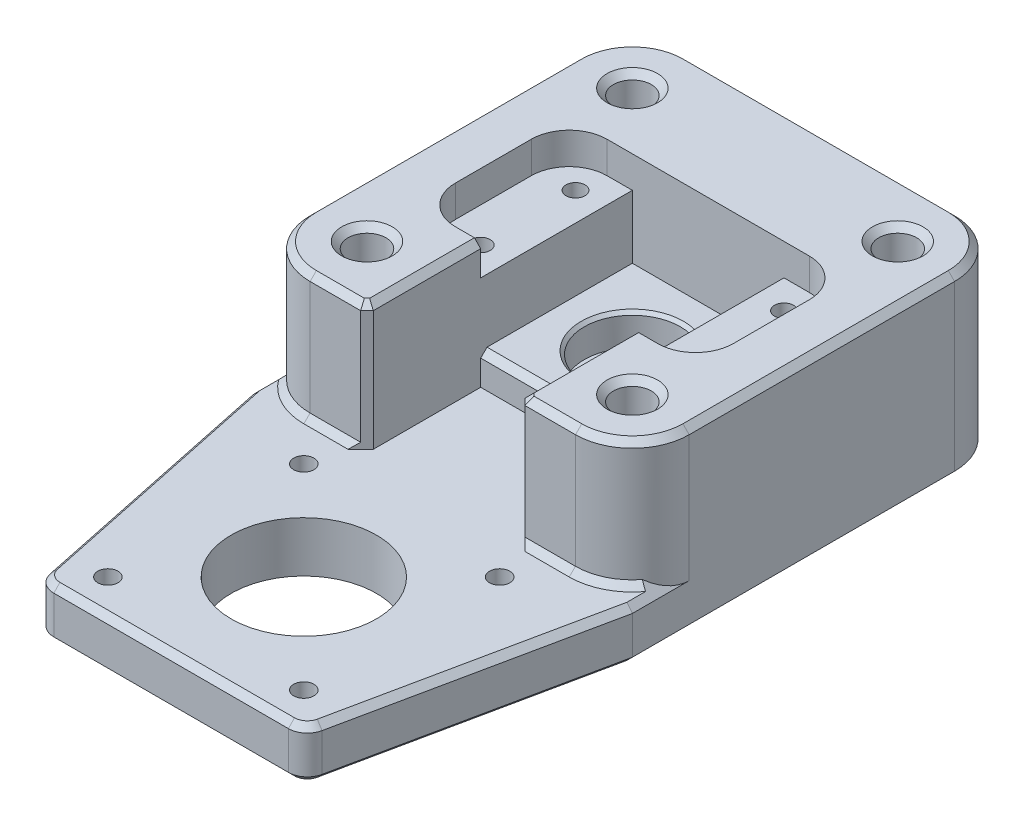
from build123d import *
from OCP.BRepFilletAPI import BRepFilletAPI_MakeChamfer

# Parameters (mm, degrees)
EXTRUDE_1_DEPTH      = 8
SKETCH_3_R           = 11.5
SKETCH_3_R_2         = 1.6
SKETCH_3_R_3         = 1.5999999999999992
SKETCH_3_R_4         = 1.6000000000000019
CUT_EXTRUDE_1_DEPTH  = 20
SKETCH_2_R           = 3.0000000000000018
SKETCH_2_R_2         = 3.0000000000000044
EXTRUDE_2_DEPTH      = 20
SKETCH_4_R           = 4.5
CUT_EXTRUDE_2_DEPTH  = 20
EXTRUDE_6_DEPTH      = 20
SKETCH_8_W           = 24.000000000000004
SKETCH_8_H           = 23.999999999999996
SKETCH_8_R           = 6.5
EXTRUDE_7_DEPTH      = 5
SKETCH_9_R           = 14.900000000000002
SKETCH_9_R_2         = 4.5
EXTRUDE_8_DEPTH      = 7
SKETCH_12_R          = 17.5
SKETCH_12_R_2        = 15
EXTRUDE_10_DEPTH     = 0.4
SKETCH_13_R          = 7.6000000000000005
CUT_EXTRUDE_4_DEPTH  = 5
FILLET_2_R           = 9
CUT_EXTRUDE_5_DEPTH  = 20
SKETCH_17_R          = 2.9999999999999996
SKETCH_17_R_2        = 2.999999999999998
SKETCH_17_R_3        = 3.0000000000000004
SKETCH_17_R_4        = 2.9999999999999987
CUT_EXTRUDE_8_DEPTH  = 3
FILLET_3_R           = 3
CHAMFER_3_SIZE       = 1
CHAMFER_4_SIZE       = 1
CHAMFER_8_SIZE       = 1
CHAMFER_11_SIZE      = 1
CHAMFER_11_SIZE2     = 0.9656887748070774
CHAMFER_12_SIZE      = 1
CHAMFER_12_SIZE2     = 0.9656887748070774
CUT_EXTRUDE_9_DEPTH  = 5
SKETCH_19_R          = 1.5000000000000009
CUT_EXTRUDE_10_DEPTH = 9.999999999999998
CHAMFER_14_SIZE      = 0.5
CHAMFER_15_SIZE      = 1
CHAMFER_16_SIZE      = 0.5
CUT_EXTRUDE_START    = -5
SKETCH_20_R          = 7.6000000000000005
CUT_EXTRUDE_11_DEPTH = 5
CHAMFER_17_SIZE      = 0.5


with BuildPart() as part:
    # 草图1 → 凸台-拉伸1 (new body)
    with BuildSketch(Plane(origin=(0, 0, 0), x_dir=(1, 0, 0), z_dir=(0, 1, 0))):
        Polygon((29.999999999999996, -7.000000000000006), (21.000000000000014, -50), (-20.999999999999986, -50), (-30.000000000000004, -7.000000000000006), (-30.000000000000004, 52.99999999999999), (29.999999999999996, 52.99999999999999), align=None)
    extrude(amount=EXTRUDE_1_DEPTH)

    # 草图3 → 切除-拉伸1 (cut)
    with BuildSketch(Plane(origin=(0, 8, 0), x_dir=(1, 0, 0), z_dir=(0, 1, 0))):
        with Locations(Location((1.33e-14, -29.000000000000007, 0), (0, 0, 270))):
            Circle(SKETCH_3_R)
        with Locations(Location((15.500000000000012, -13.500000000000009, 0), (0, 0, 270))):
            Circle(SKETCH_3_R_2)
        with Locations(Location((15.500000000000398, -44.500000000000064, 0), (0, 0, 270))):
            Circle(SKETCH_3_R_3)
        with Locations(Location((-15.499999999999662, -44.50000000000034, 0), (0, 0, 270))):
            Circle(SKETCH_3_R_3)
        with Locations(Location((-15.499999999999826, -13.500000000000288, 0), (0, 0, 270))):
            Circle(SKETCH_3_R_4)
    extrude(amount=-CUT_EXTRUDE_1_DEPTH, mode=Mode.SUBTRACT)

    # 草图2 → 凸台-拉伸2 (add)
    # profile 1 of 2: a face of its own
    with BuildSketch(Plane(origin=(0, 8, 0), x_dir=(1, 0, 0), z_dir=(0, 1, 0))):
        Polygon((-30.000000000000004, 52.99999999999999), (-12.000000000000005, 52.99999999999999), (-11.999999999999996, -7.000000000000006), (-29.999999999999996, -7.000000000000006), align=None)
        with Locations(Location((-21.000000000000004, 43.99999999999999, 0), (0, 0, 270))):
            Circle(SKETCH_2_R, mode=Mode.SUBTRACT)
        with Locations(Location((-20.999999999999993, 1.9999999999999931, 0), (0, 0, 270))):
            Circle(SKETCH_2_R_2, mode=Mode.SUBTRACT)
    # profile 2 of 2: a face of its own
    with BuildSketch(Plane(origin=(0, 8, 0), x_dir=(1, 0, 0), z_dir=(0, 1, 0))):
        Polygon((12.000000000000005, 52.99999999999999), (11.999999999999996, -7.000000000000006), (29.999999999999996, -7.000000000000006), (30.000000000000004, 52.99999999999999), align=None)
        with Locations(Location((20.999999999999993, 1.9999999999999931, 0), (0, 0, 90))):
            Circle(SKETCH_2_R_2, mode=Mode.SUBTRACT)
        with Locations(Location((21.000000000000004, 43.99999999999999, 0), (0, 0, 90))):
            Circle(SKETCH_2_R, mode=Mode.SUBTRACT)
    extrude(amount=EXTRUDE_2_DEPTH)

    # 草图4 → 切除-拉伸2 (cut)
    with BuildSketch(Plane(origin=(0, 8, 0), x_dir=(1, 0, 0), z_dir=(0, 1, 0))):
        with Locations(Location((0, 22.999999999999993, 0), (0, 0, 270))):
            Circle(SKETCH_4_R)
    extrude(amount=-CUT_EXTRUDE_2_DEPTH, mode=Mode.SUBTRACT)

    # 草图7 → 凸台-拉伸6 (add)
    with BuildSketch(Plane(origin=(0, 8, 0), x_dir=(1, 0, 0), z_dir=(0, 1, 0))):
        Polygon((12.000000000000304, 34.99999999999999), (-11.999999999999996, 34.99999999999999), (-11.999999999999996, 52.99999999999999), (12.000000000000313, 52.99999999999999), align=None)
    extrude(amount=EXTRUDE_6_DEPTH)

    # 草图8 → 凸台-拉伸7 (add)
    with BuildSketch(Plane(origin=(0, 8, 0), x_dir=(1, 0, 0), z_dir=(0, 1, 0))):
        with Locations((-1.78e-15, 22.999999999999993)):
            Rectangle(SKETCH_8_W, SKETCH_8_H)
        with Locations(Location((0, 22.999999999999993, 0), (0, 0, 270))):
            Circle(SKETCH_8_R, mode=Mode.SUBTRACT)
    extrude(amount=EXTRUDE_7_DEPTH)

    # 草图9 → 凸台-拉伸8 (add)
    with BuildSketch(Plane.XZ):
        with Locations(Location((0, -22.999999999999993, 0), (0, 0, 90))):
            Circle(SKETCH_9_R)
        with Locations(Location((0, -22.999999999999993, 0), (0, 0, 90))):
            Circle(SKETCH_9_R_2, mode=Mode.SUBTRACT)
    extrude(amount=EXTRUDE_8_DEPTH)

    # 草图12 → 凸台-拉伸10 (add)
    with BuildSketch(Plane.XZ):
        with Locations(Location((0, -22.999999999999993, 0), (0, 0, 90))):
            Circle(SKETCH_12_R)
        with Locations(Location((0, -22.999999999999993, 0), (0, 0, 270))):
            Circle(SKETCH_12_R_2, mode=Mode.SUBTRACT)
    extrude(amount=EXTRUDE_10_DEPTH)

    # 草图13 → 切除-拉伸4 (cut)
    with BuildSketch(Plane.XZ.offset(7)):
        with Locations(Location((0, -22.999999999999993, 0), (0, 0, 270))):
            Circle(SKETCH_13_R)
    extrude(amount=-CUT_EXTRUDE_4_DEPTH, mode=Mode.SUBTRACT)

    # 圆角2
    fillet_2_edges = [part.edges().sort_by_distance(p)[0] for p in [
        (-30.000000000000004, 14, -52.99999999999999),
        (30, 14, -52.99999999999999),
    ]]
    fillet(fillet_2_edges, radius=FILLET_2_R)

    # 草图14 → 切除-拉伸5 (cut)
    with BuildSketch(Plane(origin=(0, 28, 0), x_dir=(1, 0, 0), z_dir=(0, 1, 0))):
        with BuildLine():
            Line((-30.000000000000004, 1.9999999999999931), (-29.999999999999996, -7.000000000000006))
            Line((-29.999999999999996, -7.000000000000006), (-20.999999999999993, -7.000000000000015))
            ThreePointArc((-20.999999999999993, -7.000000000000015), (-27.36396103067893, -4.363961030678942), (-30.000000000000004, 1.9999999999999931))
        make_face()
        with BuildLine():
            Line((20.999999999999993, -7.000000000000006), (29.999999999999996, -7.000000000000006))
            Line((29.999999999999996, -7.000000000000006), (29.999999999999993, 1.9999999999999931))
            ThreePointArc((29.999999999999993, 1.9999999999999931), (27.363961030678922, -4.363961030678935), (20.999999999999993, -7.000000000000006))
        make_face()
    extrude(amount=-CUT_EXTRUDE_5_DEPTH, mode=Mode.SUBTRACT)

    # 草图17 → 切除-拉伸8 (cut)
    with BuildSketch(Plane.XZ):
        with Locations(Location((-15.499999999999826, 13.500000000000288, 0), (0, 0, 270))):
            Circle(SKETCH_17_R)
        with Locations(Location((-15.499999999999657, 44.4999999999999, 0), (0, 0, 270))):
            Circle(SKETCH_17_R_2)
        with Locations(Location((15.499999999999964, 44.49999999999962, 0), (0, 0, 270))):
            Circle(SKETCH_17_R_3)
        with Locations(Location((15.499999999999568, 13.500000000000009, 0), (0, 0, 270))):
            Circle(SKETCH_17_R_4)
    extrude(amount=-CUT_EXTRUDE_8_DEPTH, mode=Mode.SUBTRACT)

    # 圆角3
    fillet_3_edges = [part.edges().sort_by_distance(p)[0] for p in [
        (21.000000000000014, 4, 50),
        (-20.999999999999986, 4, 50),
    ]]
    fillet(fillet_3_edges, radius=FILLET_3_R)

    # 倒角3
    chamfer_3_edges = [part.edges().sort_by_distance(p)[0] for p in [
        (29.999999999999996, 0, -18.499999999999993),
        (25.74963598649637, 0, 27.307294731184044),
        (-7.11e-15, 0, -52.99999999999999),
        (27.36396103067893, -1.61e-15, -50.36396103067892),
        (-27.363961030678936, 0, -50.36396103067892),
        (1.066e-14, 0, 50),
        (-20.45449091092715, 0, 49.328493975416755),
        (20.45449091092717, 0, 49.328493975416755),
        (-25.749635986496358, 0, 27.307294731184044),
        (-30.000000000000004, 0, -18.499999999999993),
    ]]
    chamfer(chamfer_3_edges, length=CHAMFER_3_SIZE)

    # 倒角4
    chamfer_4_edges = [part.edges().sort_by_distance(p)[0] for p in [
        (-11.999999999999996, 18, 7.000000000000006),
        (11.999999999999996, 18, 7.000000000000006),
    ]]
    chamfer(chamfer_4_edges, length=CHAMFER_4_SIZE)

    # 倒角8
    chamfer_8_edges = [part.edges().sort_by_distance(p)[0] for p in [
        (0, 13, -10.999999999999996),
    ]]
    chamfer(chamfer_8_edges, length=CHAMFER_8_SIZE)

    # 倒角11: one chamfer whose edges measure the first distance from different faces: ONE call of the kernel's chamfer builder (chamfer() names one face for all edges)
    chamfer_11_edges_1 = [part.edges().sort_by_distance(p)[0] for p in [
        (-30, 8, 2.500000000000007),
    ]]
    chamfer_11_side_1 = [part.faces().sort_by_distance(p)[0] for p in [
        (-30.000000000000007, 13.973684210526315, -21.657894736842096),
    ]]
    chamfer_11_edges_2 = [part.edges().sort_by_distance(p)[0] for p in [
        (29.999999999999993, 8, 2.500000000000006),
    ]]
    chamfer_11_side_2 = [part.faces().sort_by_distance(p)[0] for p in [
        (29.999999999999993, 13.973684210526315, -21.657894736842096),
    ]]
    chamfer_11_edges_3 = [part.edges().sort_by_distance(p)[0] for p in [
        (1.066e-14, 8, 50),
    ]]
    chamfer_11_side_3 = [part.faces().sort_by_distance(p)[0] for p in [
        (1.113e-14, 4.5, 50),
    ]]
    chamfer_11_edges_4 = [part.edges().sort_by_distance(p)[0] for p in [
        (-20.45449091092715, 8, 49.328493975416755),
    ]]
    chamfer_11_side_4 = [part.faces().sort_by_distance(p)[0] for p in [
        (-20.45449091092715, 4.5, 49.328493975416755),
    ]]
    chamfer_11_edges_5 = [part.edges().sort_by_distance(p)[0] for p in [
        (20.45449091092717, 8, 49.328493975416755),
    ]]
    chamfer_11_side_5 = [part.faces().sort_by_distance(p)[0] for p in [
        (20.45449091092717, 4.5, 49.328493975416755),
    ]]
    chamfer_11_edges_6 = [part.edges().sort_by_distance(p)[0] for p in [
        (-25.749635986496358, 8, 27.307294731184044),
    ]]
    chamfer_11_side_6 = [part.faces().sort_by_distance(p)[0] for p in [
        (-25.74963598649636, 4.5, 27.307294731184037),
    ]]
    chamfer_11_edges_7 = [part.edges().sort_by_distance(p)[0] for p in [
        (25.74963598649637, 8, 27.307294731184044),
    ]]
    chamfer_11_side_7 = [part.faces().sort_by_distance(p)[0] for p in [
        (25.74963598649637, 4.5, 27.307294731184044),
    ]]
    chamfer_11 = BRepFilletAPI_MakeChamfer(part.part.solid().wrapped)
    for e in chamfer_11_edges_1:
        chamfer_11.Add(CHAMFER_11_SIZE, CHAMFER_11_SIZE2, e.wrapped, chamfer_11_side_1[0].wrapped)  # the first distance lies on this face
    for e in chamfer_11_edges_2:
        chamfer_11.Add(CHAMFER_11_SIZE, CHAMFER_11_SIZE2, e.wrapped, chamfer_11_side_2[0].wrapped)  # the first distance lies on this face
    for e in chamfer_11_edges_3:
        chamfer_11.Add(CHAMFER_11_SIZE, CHAMFER_11_SIZE2, e.wrapped, chamfer_11_side_3[0].wrapped)  # the first distance lies on this face
    for e in chamfer_11_edges_4:
        chamfer_11.Add(CHAMFER_11_SIZE, CHAMFER_11_SIZE2, e.wrapped, chamfer_11_side_4[0].wrapped)  # the first distance lies on this face
    for e in chamfer_11_edges_5:
        chamfer_11.Add(CHAMFER_11_SIZE, CHAMFER_11_SIZE2, e.wrapped, chamfer_11_side_5[0].wrapped)  # the first distance lies on this face
    for e in chamfer_11_edges_6:
        chamfer_11.Add(CHAMFER_11_SIZE, CHAMFER_11_SIZE2, e.wrapped, chamfer_11_side_6[0].wrapped)  # the first distance lies on this face
    for e in chamfer_11_edges_7:
        chamfer_11.Add(CHAMFER_11_SIZE, CHAMFER_11_SIZE2, e.wrapped, chamfer_11_side_7[0].wrapped)  # the first distance lies on this face
    add(Compound.cast(chamfer_11.Shape()), mode=Mode.REPLACE)

    # 倒角12
    chamfer_12_edges = [part.edges().sort_by_distance(p)[0] for p in [
        (-16.999999999999993, 8, 7.000000000000006),
        (25.716854588488776, 8, 5.664938537982707),
        (16.999999999999993, 8, 7.000000000000006),
        (-25.716854588488772, 8, 5.664938537982719),
    ]]
    chamfer_12_side = [part.faces().sort_by_distance(p)[0] for p in [
        (-26.15459416328618, 8, 6.376269971572619),
    ]]
    chamfer(chamfer_12_edges, length=CHAMFER_12_SIZE, length2=CHAMFER_12_SIZE2, reference=chamfer_12_side[0])

    # 草图18 → 切除-拉伸9 (cut)
    with BuildSketch(Plane(origin=(0, 28, 0), x_dir=(1, 0, 0), z_dir=(0, 1, 0))):
        with BuildLine():
            Line((-15.999999999999956, 34.99999999999999), (15.999999999999956, 34.99999999999999))
            ThreePointArc((15.999999999999956, 34.99999999999999), (20.242640687119287, 33.24264068711928), (22, 28.999999999999947))
            Line((22, 28.999999999999947), (22, 17.000000000000036))
            ThreePointArc((22, 17.000000000000036), (20.242640687119284, 12.757359312880707), (15.999999999999956, 10.999999999999993))
            Line((15.999999999999956, 10.999999999999993), (-15.999999999999956, 10.999999999999993))
            ThreePointArc((-15.999999999999956, 10.999999999999993), (-20.242640687119284, 12.757359312880709), (-22, 17.000000000000036))
            Line((-22, 17.000000000000036), (-22, 28.999999999999947))
            ThreePointArc((-22, 28.999999999999947), (-20.242640687119287, 33.24264068711928), (-15.999999999999956, 34.99999999999999))
        make_face()
    extrude(amount=-CUT_EXTRUDE_9_DEPTH, mode=Mode.SUBTRACT)

    # 草图19 → 切除-拉伸10 (cut)
    with BuildSketch(Plane(origin=(0, 23, 0), x_dir=(1, 0, 0), z_dir=(0, 1, 0))):
        with Locations(Location((16.5, 30.49999999999999, 0), (0, 0, 270))):
            Circle(SKETCH_19_R)
        with Locations(Location((16.500000000000306, 15.499999999999993, 0), (0, 0, 270))):
            Circle(SKETCH_19_R)
        with Locations(Location((-16.500000000000004, 30.49999999999999, 0), (0, 0, 270))):
            Circle(SKETCH_19_R)
        with Locations(Location((-16.500000000000004, 15.499999999999993, 0), (0, 0, 270))):
            Circle(SKETCH_19_R)
    extrude(amount=-CUT_EXTRUDE_10_DEPTH, mode=Mode.SUBTRACT)

    # 倒角14
    chamfer_14_edges = [part.edges().sort_by_distance(p)[0] for p in [
        (-2.74e-15, -7, -37.89999999999999),
    ]]
    chamfer(chamfer_14_edges, length=CHAMFER_14_SIZE)

    # 倒角15
    chamfer_15_edges = [part.edges().sort_by_distance(p)[0] for p in [
        (-30, 28, -22.999999999999993),
        (-3.55e-15, 28, -52.99999999999999),
        (27.363961030678936, 28, -50.36396103067892),
        (-27.363961030678936, 28, -50.36396103067892),
        (-16.999999999999993, 28, 7.000000000000006),
        (-27.36396103067893, 28, 4.363961030678943),
        (30, 28, -22.999999999999993),
        (27.363961030678922, 28, 4.363961030678935),
        (16.999999999999993, 28, 7.000000000000006),
        (-11.999999999999998, 28, -2.499999999999993),
        (-12.5, 28, 6.500000000000009),
        (12.499999999999996, 28, 6.500000000000006),
        (11.999999999999998, 28, -2.499999999999993),
        (-21.000000000000004, 28, -46.99999999999999),
        (-20.999999999999993, 28, -4.999999999999997),
        (20.999999999999993, 28, 1.0000000000000113),
        (21.000000000000004, 28, -40.99999999999999),
    ]]
    chamfer(chamfer_15_edges, length=CHAMFER_15_SIZE)

    # 倒角16
    chamfer_16_edges = [part.edges().sort_by_distance(p)[0] for p in [
        (2.33e-15, -7, -15.399999999999991),
    ]]
    chamfer(chamfer_16_edges, length=CHAMFER_16_SIZE)

    # 草图20 → 切除-拉伸11 (cut)
    with BuildSketch(Plane(origin=(0, 13.000000000000002, 0), x_dir=(1, 0, 0), z_dir=(0, 1, 0)).offset(CUT_EXTRUDE_START)):
        with Locations(Location((0, 22.999999999999993, 0), (0, 0, 90))):
            Circle(SKETCH_20_R)
    extrude(amount=CUT_EXTRUDE_11_DEPTH, mode=Mode.SUBTRACT)

    # 倒角17
    chamfer_17_edges = [part.edges().sort_by_distance(p)[0] for p in [
        (-1.4e-15, 13.000000000000002, -15.399999999999991),
    ]]
    chamfer(chamfer_17_edges, length=CHAMFER_17_SIZE)


solid = part.part
